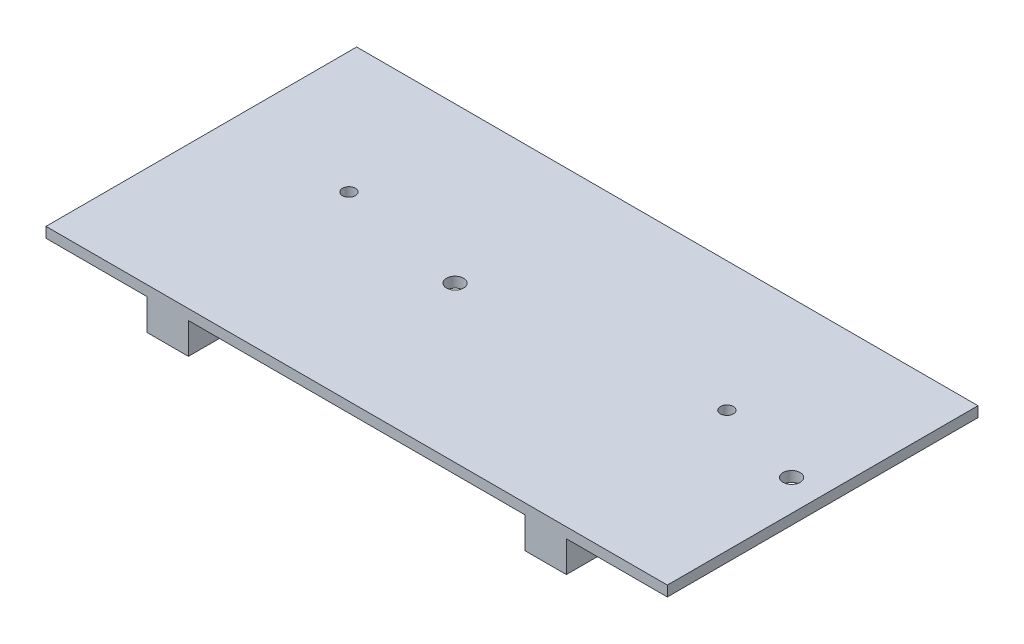
from build123d import *

# Parameters (mm, degrees)
SKETCH_1_W             = 120
SKETCH_1_H             = 60
EXTRUDE_1_DEPTH        = 2
SKETCH_2_W             = 8
SKETCH_2_H             = 60
EXTRUDE_2_DEPTH        = 6
HOLE_WIZARD_M3_1_D     = 2.5
HOLE_WIZARD_M3_1_DEPTH = 8.5
HOLE_WIZARD_M3_1_TIP   = 0.751075774
HOLE_WIZARD_M4_1_D     = 3.3


with BuildPart() as part:
    # 草图1 → 凸台-拉伸1 (new body)
    with BuildSketch(Plane(origin=(0, 0, 0), x_dir=(1, 0, 0), z_dir=(0, 1, 0))):
        Rectangle(SKETCH_1_W, SKETCH_1_H)
    extrude(amount=EXTRUDE_1_DEPTH)

    # 草图2 → 凸台-拉伸2 (add)
    with BuildSketch(Plane.XZ):
        with Locations((-36.5, 0)):
            Rectangle(SKETCH_2_W, SKETCH_2_H)
        with Locations((36.5, 0)):
            Rectangle(SKETCH_2_W, SKETCH_2_H)
    extrude(amount=EXTRUDE_2_DEPTH)

    # M3 螺纹孔1
    with Locations(Plane(origin=(0, -6, 0), x_dir=(-1, 0, 0), z_dir=(0, -1, 0))):
        with Locations((36.5, 5), (-36.5, 5)):
            Hole(HOLE_WIZARD_M3_1_D / 2, depth=HOLE_WIZARD_M3_1_DEPTH)
            with Locations((0, 0, -(HOLE_WIZARD_M3_1_DEPTH + HOLE_WIZARD_M3_1_TIP / 2))):  # 118° drill point
                Cone(0, HOLE_WIZARD_M3_1_D / 2, HOLE_WIZARD_M3_1_TIP, mode=Mode.SUBTRACT)

    # M4 螺纹孔1 (through all)
    with Locations(Plane(origin=(0, 2, 0), x_dir=(1, 0, 0), z_dir=(0, 1, 0))):
        with Locations((54, 0), (-11, 0)):
            Hole(HOLE_WIZARD_M4_1_D / 2)


solid = part.part
